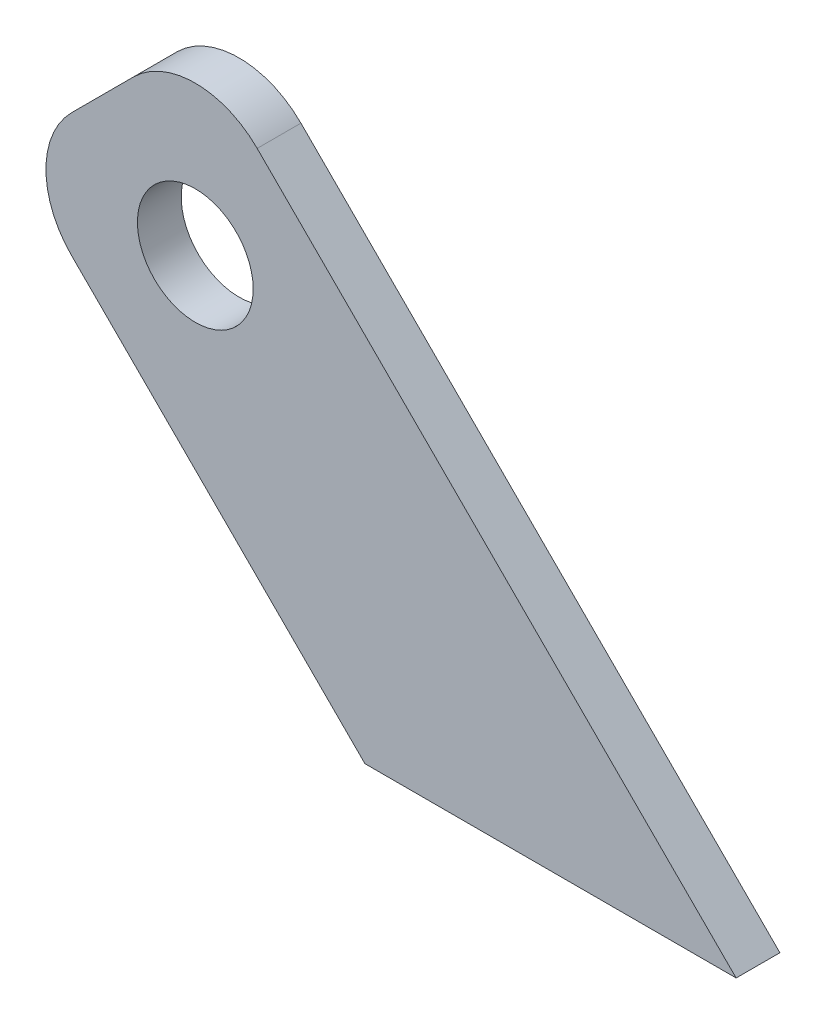
from build123d import *

# Parameters (mm, degrees)
SKETCH1_R           = 4.19989
BOSS_EXTRUDE1_DEPTH = 3.175


with BuildPart() as part:
    # Sketch1 → Boss-Extrude1 (new body)
    with BuildSketch(Plane.XY):
        with BuildLine():
            Line((33.609915001, 47.079525356), (29.119959184, 42.589655658))
            ThreePointArc((29.119959184, 42.589655658), (27.260044183, 38.099545434), (29.119873062, 33.609399537))
            Line((29.119873062, 33.609399537), (40.344999438, 22.384057856))
            Line((40.344999438, 22.384057856), (50.410250348, 12.319))
            Line((50.410250348, 12.319), (77.351277082, 12.319))
            Line((77.351277082, 12.319), (42.590084999, 47.079525356))
            ThreePointArc((42.590084999, 47.079525356), (38.1, 48.939354235), (33.609915001, 47.079525356))
        make_face()
        with Locations((38.1, 38.099269235)):
            Circle(SKETCH1_R, mode=Mode.SUBTRACT)
    extrude(amount=BOSS_EXTRUDE1_DEPTH)


solid = part.part
